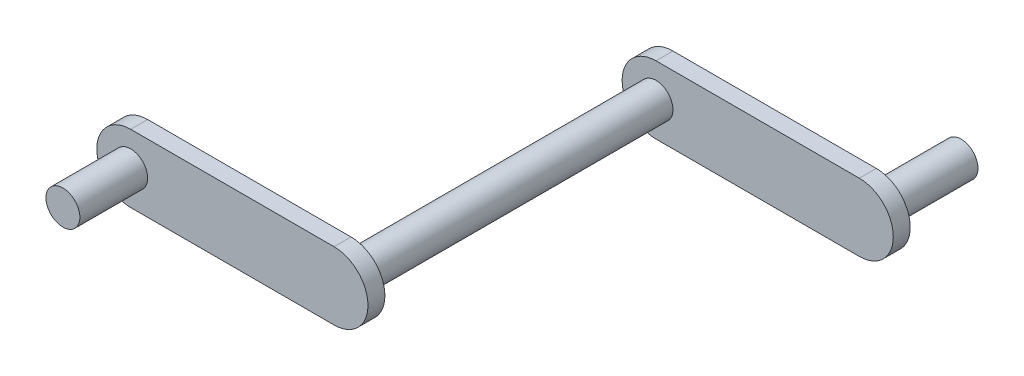
from build123d import *

# Parameters (mm, degrees)
SKETCH1_R           = 31.75
BOSS_EXTRUDE1_DEPTH = 15.875
SKETCH2_R           = 31.75
BOSS_EXTRUDE2_DEPTH = 571.5
BOSS_EXTRUDE3_START = -190.5
SKETCH4_R           = 31.75
BOSS_EXTRUDE3_DEPTH = 190.5
BOSS_EXTRUDE4_START = 31.75
BOSS_EXTRUDE4_DEPTH = 31.75
SKETCH7_R           = 31.75
BOSS_EXTRUDE5_DEPTH = 127


with BuildPart() as part:
    # Sketch1 → Boss-Extrude1 (new, symmetric)
    with BuildSketch(Plane.XY):
        with BuildLine():
            Line((-190.5, 63.657439452), (190.5, 63.657439452))
            ThreePointArc((190.5, 63.657439452), (254, 0.157439452), (190.5, -63.342560548))
            Line((190.5, -63.342560548), (-190.5, -63.342560548))
            ThreePointArc((-190.5, -63.342560548), (-254, 0.157439452), (-190.5, 63.657439452))
        make_face()
        with Locations((190.5, 0.157439452)):
            Circle(SKETCH1_R, mode=Mode.SUBTRACT)
    extrude(amount=BOSS_EXTRUDE1_DEPTH, both=True)

    # Sketch2 → Boss-Extrude2 (add)
    with BuildSketch(Plane.XY.offset(15.875)):
        with Locations((-190.5, 0.157439452)):
            Circle(SKETCH2_R)
    extrude(amount=BOSS_EXTRUDE2_DEPTH)

    # Sketch4 → Boss-Extrude3 (add)
    with BuildSketch(Plane.XY.offset(15.875).offset(BOSS_EXTRUDE3_START)):
        with Locations((190.5, 0.157439452)):
            Circle(SKETCH4_R)
    extrude(amount=BOSS_EXTRUDE3_DEPTH)

    # Sketch6 → Boss-Extrude4 (add)
    with BuildSketch(Plane.XY.offset(587.375).offset(BOSS_EXTRUDE4_START)):
        with BuildLine():
            Line((-571.5, 63.657439452), (-190.5, 63.657439452))
            ThreePointArc((-190.5, 63.657439452), (-127, 0.157439452), (-190.5, -63.342560548))
            Line((-190.5, -63.342560548), (-571.5, -63.342560548))
            ThreePointArc((-571.5, -63.342560548), (-635, 0.157439452), (-571.5, 63.657439452))
        make_face()
    extrude(amount=-BOSS_EXTRUDE4_DEPTH)

    # Sketch7 → Boss-Extrude5 (add)
    with BuildSketch(Plane.XY.offset(619.125)):
        with Locations((-571.5, 0.157439452)):
            Circle(SKETCH7_R)
    extrude(amount=BOSS_EXTRUDE5_DEPTH)


solid = part.part
